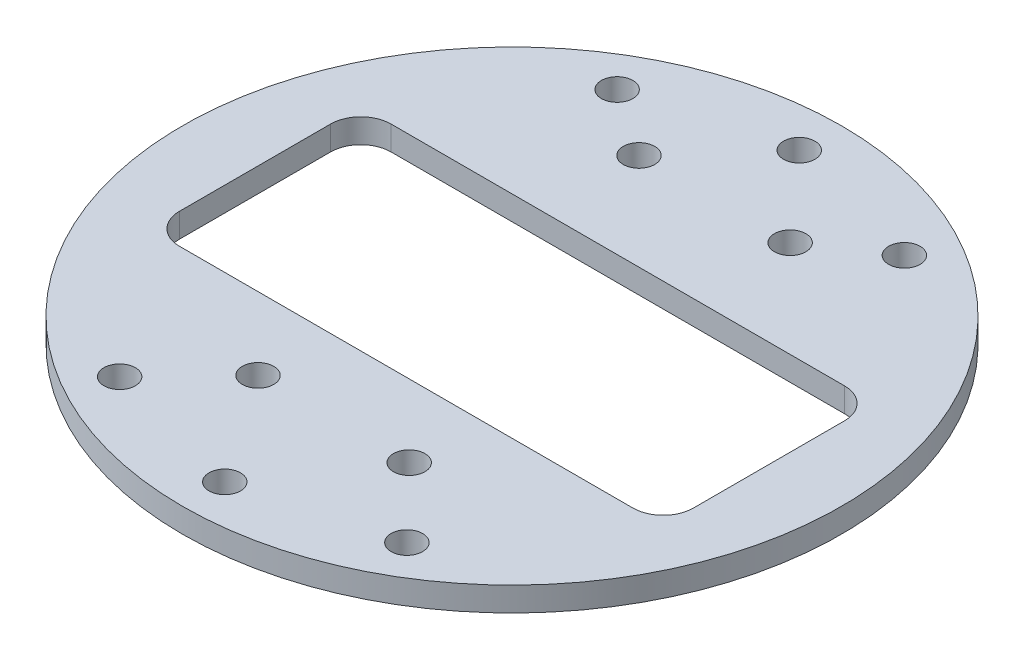
from build123d import *

# Parameters (mm, degrees)
SKETCH_1_R               = 54.5
EXTRUDE_1_DEPTH          = 4
SKETCH_2_W               = 85
SKETCH_2_H               = 35
CUT_EXTRUDE_1_DEPTH      = 4
FILLET_1_R               = 5
SKETCH_3_R               = 2.6
CUT_EXTRUDE_2_DEPTH      = 10
PATTERN_CIRCULAR_1_COUNT = 2
SKETCH_4_R               = 2.6
CUT_EXTRUDE_3_DEPTH      = 10
SKETCH_5_R               = 2.6
CUT_EXTRUDE_4_DEPTH      = 100


with BuildPart() as part:
    # 草图1 → 凸台-拉伸1 (new body)
    with BuildSketch(Plane(origin=(0, 0, 0), x_dir=(1, 0, 0), z_dir=(0, 1, 0))):
        with Locations(Location((0, 0, 0), (0, 0, 270))):
            Circle(SKETCH_1_R)
    extrude(amount=EXTRUDE_1_DEPTH)

    # 草图2 → 切除-拉伸1 (cut)
    with BuildSketch(Plane(origin=(0, 4, 0), x_dir=(1, 0, 0), z_dir=(0, 1, 0))):
        Rectangle(SKETCH_2_W, SKETCH_2_H)
    extrude(amount=-CUT_EXTRUDE_1_DEPTH, mode=Mode.SUBTRACT)

    # 圆角1
    fillet_1_edges = [part.edges().sort_by_distance(p)[0] for p in [
        (42.5, 2, -17.5),
        (42.5, 2, 17.5),
        (-42.5, 2, 17.5),
        (-42.5, 2, -17.5),
    ]]
    fillet(fillet_1_edges, radius=FILLET_1_R)

    # 草图3 → 切除-拉伸2 (cut)
    with BuildSketch(Plane.XZ):
        with Locations(Location((-23.75, 41.13620668, 0), (0, 0, 270))):
            Circle(SKETCH_3_R)
        with Locations(Location((23.75, 41.13620668, 0), (0, 0, 270))):
            Circle(SKETCH_3_R)
        with Locations(Location((0, 47.5, 0), (0, 0, 270))):
            Circle(SKETCH_3_R)
    cut_extrude_2 = extrude(amount=-CUT_EXTRUDE_2_DEPTH, mode=Mode.SUBTRACT)

    # 阵列(圆周)1: 切除-拉伸2 ×2 about axis
    pattern_circular_1_axis = Axis((0, 0, 0), (0, 1, 0))
    for i in range(1, PATTERN_CIRCULAR_1_COUNT):
        add(cut_extrude_2.rotate(pattern_circular_1_axis, i * 360 / PATTERN_CIRCULAR_1_COUNT), mode=Mode.SUBTRACT)

    # 草图4 → 切除-拉伸3 (cut)
    with BuildSketch(Plane.XZ):
        with Locations(Location((-12.5, 29.5, 0), (0, 0, 270))):
            Circle(SKETCH_4_R)
        with Locations(Location((12.5, 29.5, 0), (0, 0, 270))):
            Circle(SKETCH_4_R)
    extrude(amount=-CUT_EXTRUDE_3_DEPTH, mode=Mode.SUBTRACT)

    # 草图5 → 切除-拉伸4 (cut)
    with BuildSketch(Plane.XZ):
        with Locations(Location((-12.5, -33.5, 0), (0, 0, 270))):
            Circle(SKETCH_5_R)
        with Locations(Location((12.5, -33.5, 0), (0, 0, 270))):
            Circle(SKETCH_5_R)
    extrude(amount=-CUT_EXTRUDE_4_DEPTH, mode=Mode.SUBTRACT)


solid = part.part
